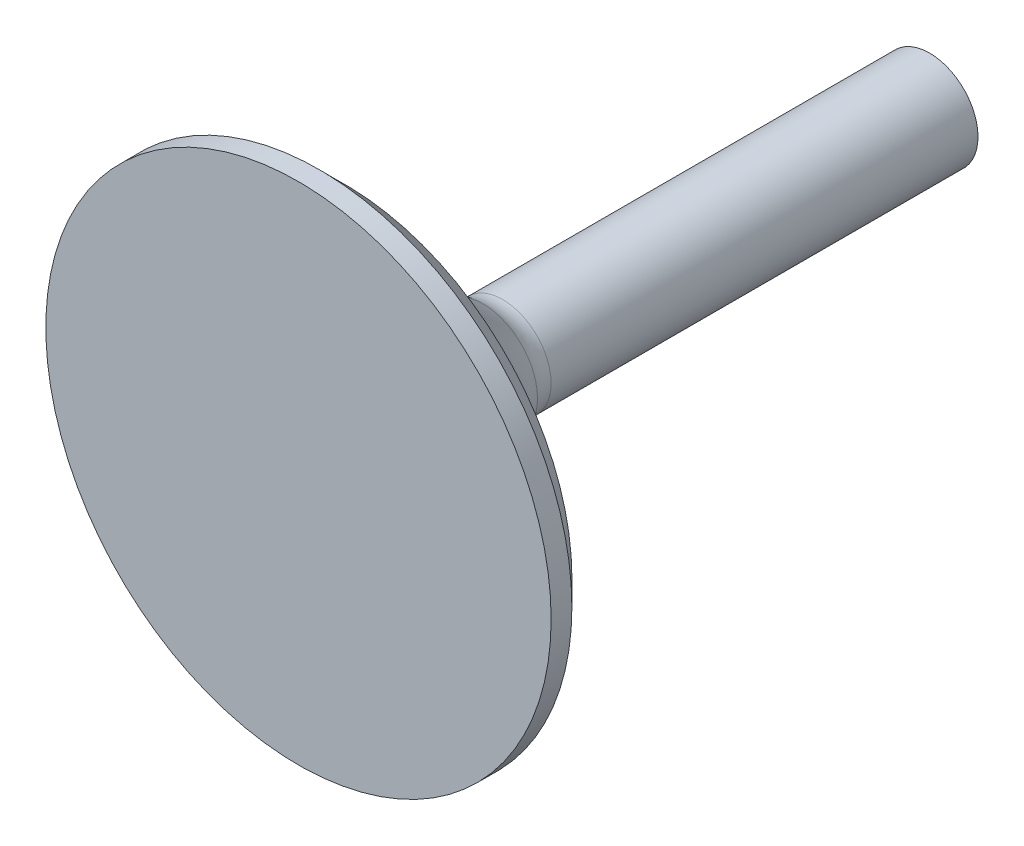
from build123d import *


with BuildPart() as part:
    # Sketch1 → Revolve1 (revolve)
    with BuildSketch(Plane(origin=(0, 0, 0), x_dir=(1, 0, 0), z_dir=(0, 1, 0))):
        with BuildLine():
            Line((0, -25.572091464), (18.57375, -25.572091464))
            Line((18.57375, -25.572091464), (18.57375, -24.046641665))
            Line((18.57375, -24.046641665), (16.684625, -22.157516665))
            add(Edge.make_bspline(
                [(16.684625, -22.157516665), (11.468108673, -19.962544079), (7.225955877, -16.564924261), (4.020652898, -12.022441155)],
                knots=[0, 0, 0, 0, 0.953211626, 0.953211626, 0.953211626, 0.953211626], degree=3))
            ThreePointArc((4.020652898, -12.022441155), (3.674948406, -11.326203905), (3.556, -10.558018263))
            Line((3.556, -10.558018263), (3.556, 20.823171826))
            Line((3.556, 20.823171826), (0, 20.823171826))
            Line((0, 20.823171826), (0, -25.572091464))
        make_face()
    revolve(axis=Axis((0, 0, 25.572091464), (0, 0, -1)))


solid = part.part
